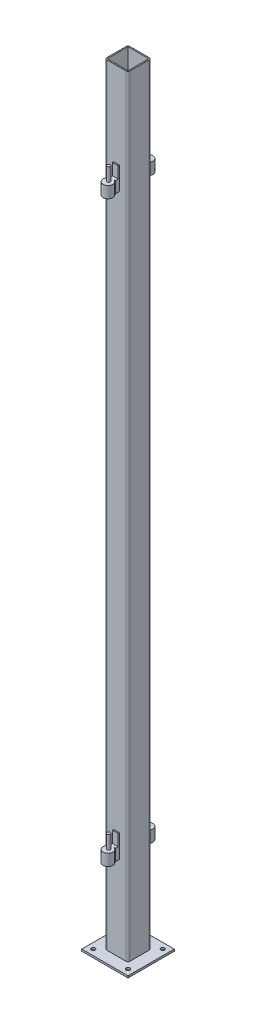
from build123d import *

# Parameters (mm, degrees)
SKETCH_1_W               = 120
SKETCH_1_H               = 120
EXTRUDE_1_DEPTH          = 5
SKETCH_2_W               = 60
SKETCH_2_H               = 60
SKETCH_2_W_2             = 54
SKETCH_2_H_2             = 54
EXTRUDE_2_DEPTH          = 2000
FILLET_1_R               = 5
SKETCH_3_R               = 5
CUT_EXTRUDE_1_DEPTH      = 2000
EXTRUDE_5_DEPTH          = 7.5
PATTERN_LINEAR_1_COUNT   = 2
PATTERN_LINEAR_1_PITCH   = 1500
SKETCH_7_R               = 12.5
EXTRUDE_6_DEPTH          = 30
SKETCH_8_R               = 4
EXTRUDE_7_DEPTH          = 35
PATTERN_LINEAR_2_COUNT   = 2
PATTERN_LINEAR_2_PITCH   = 1500
MIRROR_1_COPY_1_DEPTH    = 7.5
MIRROR_1_COPY_2_SKETCH_R = 12.5
MIRROR_1_COPY_2_DEPTH    = 30
MIRROR_1_COPY_3_SKETCH_R = 4
MIRROR_1_COPY_3_DEPTH    = 35


with BuildPart() as part:
    # 草图1 → 凸台-拉伸1 (new body)
    with BuildSketch(Plane(origin=(0, 0, 0), x_dir=(1, 0, 0), z_dir=(0, 1, 0))):
        Rectangle(SKETCH_1_W, SKETCH_1_H)
    extrude(amount=EXTRUDE_1_DEPTH)

    # 草图2 → 凸台-拉伸2 (add)
    with BuildSketch(Plane(origin=(0, 5, 0), x_dir=(1, 0, 0), z_dir=(0, 1, 0))):
        Rectangle(SKETCH_2_W, SKETCH_2_H)
        Rectangle(SKETCH_2_W_2, SKETCH_2_H_2, mode=Mode.SUBTRACT)
    extrude(amount=EXTRUDE_2_DEPTH)

    # 圆角1
    fillet_1_edges = [part.edges().sort_by_distance(p)[0] for p in [
        (30, 1005, -30),
        (-30, 1005, -30),
        (-30, 1005, 30),
        (30, 1005, 30),
    ]]
    fillet(fillet_1_edges, radius=FILLET_1_R)

    # 草图3 → 切除-拉伸1 (cut)
    with BuildSketch(Plane(origin=(0, 5, 0), x_dir=(1, 0, 0), z_dir=(0, 1, 0))):
        with Locations(Location((-45, 45, 0), (0, 0, 270))):
            Circle(SKETCH_3_R)
        with Locations(Location((45, 45, 0), (0, 0, 270))):
            Circle(SKETCH_3_R)
        with Locations(Location((-45, -45, 0), (0, 0, 270))):
            Circle(SKETCH_3_R)
        with Locations(Location((45, -45, 0), (0, 0, 270))):
            Circle(SKETCH_3_R)
    extrude(amount=-CUT_EXTRUDE_1_DEPTH, mode=Mode.SUBTRACT)

    # 草图6 → 凸台-拉伸5 (add, symmetric)
    with BuildSketch(Plane(origin=(0, 0, 0), x_dir=(0, 0, -1), z_dir=(1, 0, 0))):
        Polygon((30, 1785), (30, 1725), (40, 1725), (40, 1755), (33, 1755), (33, 1785), align=None)
    extrude_5 = extrude(amount=EXTRUDE_5_DEPTH, both=True)

    # 阵列(线性)1: 凸台-拉伸5 ×2
    with Locations(*[(0, -i * PATTERN_LINEAR_1_PITCH, 0) for i in range(1, PATTERN_LINEAR_1_COUNT)]):
        add(extrude_5)

    # 草图7 → 凸台-拉伸6 (add)
    with BuildSketch(Plane(origin=(0, 1755, 0), x_dir=(1, 0, 0), z_dir=(0, 1, 0))):
        with Locations((0, 52)):
            Circle(SKETCH_7_R)
    extrude_6 = extrude(amount=-EXTRUDE_6_DEPTH)

    # 草图8 → 凸台-拉伸7 (add)
    with BuildSketch(Plane(origin=(0, 1755, 0), x_dir=(1, 0, 0), z_dir=(0, 1, 0))):
        with Locations(Location((0, 50, 0), (0, 0, 90))):
            Circle(SKETCH_8_R)
    extrude_7 = extrude(amount=EXTRUDE_7_DEPTH)

    # 阵列(线性)2: 凸台-拉伸6, 凸台-拉伸7 ×2
    with Locations(*[(0, -i * PATTERN_LINEAR_2_PITCH, 0) for i in range(1, PATTERN_LINEAR_2_COUNT)]):
        add(extrude_6)
        add(extrude_7)

    # 镜向1: 凸台-拉伸5, 凸台-拉伸6, 凸台-拉伸7 across plane
    add(extrude_5.mirror(Plane(origin=(0, 0, 0), x_dir=(1, 0, 0), z_dir=(0, 0, -1))))
    add(extrude_6.mirror(Plane(origin=(0, 0, 0), x_dir=(1, 0, 0), z_dir=(0, 0, -1))))
    add(extrude_7.mirror(Plane(origin=(0, 0, 0), x_dir=(1, 0, 0), z_dir=(0, 0, -1))))

    # 镜向1 copy 1 sketch → 镜向1 copy 1 (add, symmetric)
    with BuildSketch(Plane(origin=(0, -1500, 0), x_dir=(0, 0, 1), z_dir=(1, 0, 0))):
        Polygon((30, -1785), (30, -1725), (40, -1725), (40, -1755), (33, -1755), (33, -1785), align=None)
    extrude(amount=MIRROR_1_COPY_1_DEPTH, both=True)

    # 镜向1 copy 2 sketch → 镜向1 copy 2 (add)
    with BuildSketch(Plane(origin=(0, 255, 0), x_dir=(1, 0, 0), z_dir=(0, 1, 0))):
        with Locations((0, -52)):
            Circle(MIRROR_1_COPY_2_SKETCH_R)
    extrude(amount=-MIRROR_1_COPY_2_DEPTH)

    # 镜向1 copy 3 sketch → 镜向1 copy 3 (add)
    with BuildSketch(Plane(origin=(0, 255, 0), x_dir=(1, 0, 0), z_dir=(0, 1, 0))):
        with Locations((0, -50)):
            Circle(MIRROR_1_COPY_3_SKETCH_R)
    extrude(amount=MIRROR_1_COPY_3_DEPTH)


solid = part.part
